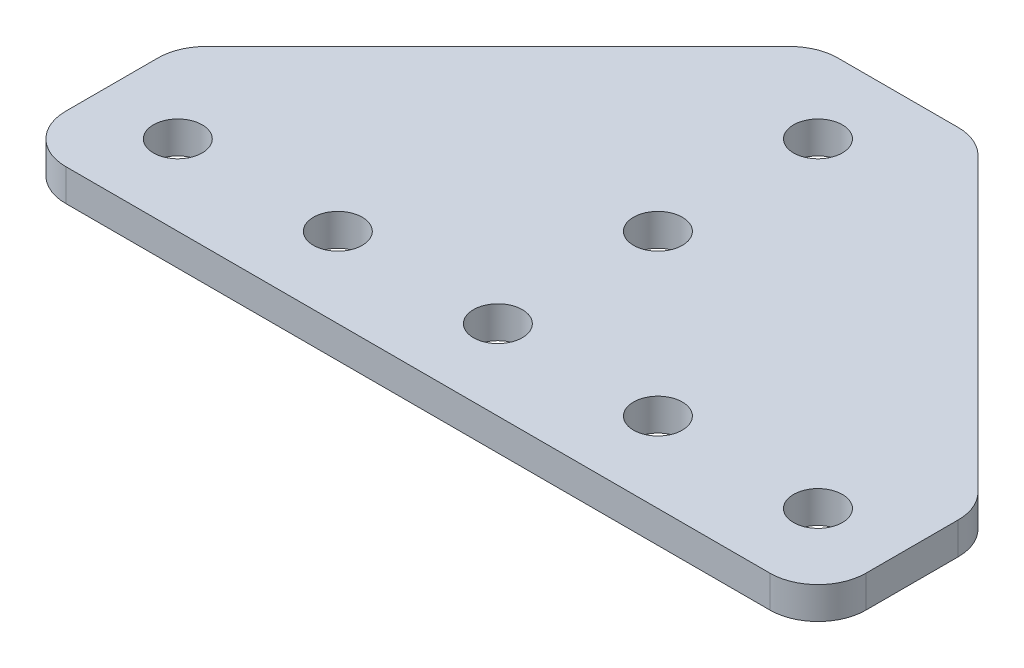
from build123d import *

# Parameters (mm, degrees)
SKETCH_1_R      = 1.525
EXTRUDE_1_DEPTH = 2
FILLET_1_R      = 3


with BuildPart() as part:
    # 草图1 → 凸台-拉伸1 (new body)
    with BuildSketch(Plane(origin=(0, 0, 0), x_dir=(1, 0, 0), z_dir=(0, 1, 0))):
        Polygon((-5, 30), (5, 30), (25, 10), (25, 0), (-25, 0), (-25, 10), align=None)
        with Locations(Location((0, 25, 0), (0, 0, 270))):
            Circle(SKETCH_1_R, mode=Mode.SUBTRACT)
        with Locations(Location((0, 15, 0), (0, 0, 270))):
            Circle(SKETCH_1_R, mode=Mode.SUBTRACT)
        with Locations(Location((0, 5, 0), (0, 0, 270))):
            Circle(SKETCH_1_R, mode=Mode.SUBTRACT)
        with Locations(Location((10, 5, 0), (0, 0, 270))):
            Circle(SKETCH_1_R, mode=Mode.SUBTRACT)
        with Locations(Location((-10, 5, 0), (0, 0, 270))):
            Circle(SKETCH_1_R, mode=Mode.SUBTRACT)
        with Locations(Location((20, 5, 0), (0, 0, 270))):
            Circle(SKETCH_1_R, mode=Mode.SUBTRACT)
        with Locations(Location((-20, 5, 0), (0, 0, 270))):
            Circle(SKETCH_1_R, mode=Mode.SUBTRACT)
    extrude(amount=EXTRUDE_1_DEPTH)

    # 圆角1
    fillet_1_edges = [part.edges().sort_by_distance(p)[0] for p in [
        (-5, 1, -30),
        (5, 1, -30),
        (25, 1, -10),
        (25, 1, 0),
        (-25, 1, 0),
        (-25, 1, -10),
    ]]
    fillet(fillet_1_edges, radius=FILLET_1_R)


solid = part.part
